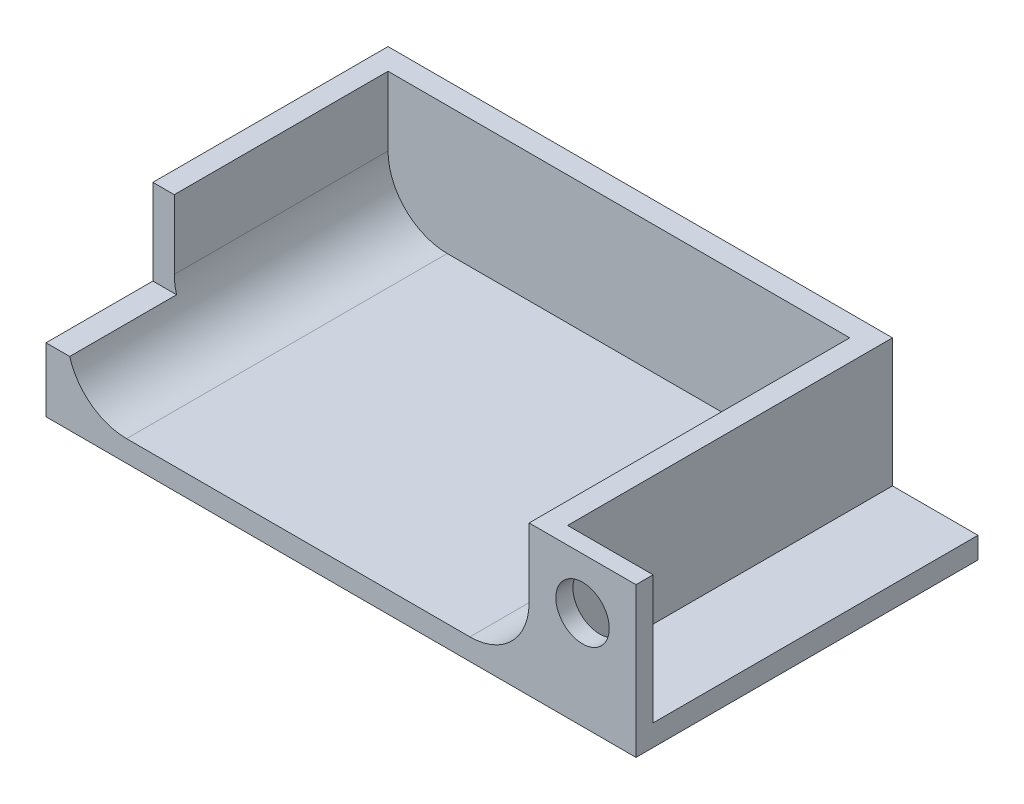
from build123d import *

# Parameters (mm, degrees)
ESQUISSE1_W             = 138
ESQUISSE1_H             = 75
BOSS_EXTRU_1_DEPTH      = 5
ESQUISSE2_W             = 5
ESQUISSE2_H             = 75
ESQUISSE2_W_2           = 25
BOSS_EXTRU_2_DEPTH      = 30
CONG_1_R                = 13.85
ESQUISSE3_W             = 138
ESQUISSE3_H             = 35
BOSS_EXTRU_3_DEPTH      = 5
ESQUISSE4_W             = 25
ESQUISSE4_H             = 20
ENL_V_MAT_EXTRU_1_DEPTH = 6
ESQUISSE5_W             = 20
ESQUISSE5_H             = 76
ENL_V_MAT_EXTRU_2_DEPTH = 30
ESQUISSE6_R             = 6.25
ENL_V_MAT_EXTRU_3_DEPTH = 4


with BuildPart() as part:
    # Esquisse1 → Boss.-Extru.1 (new body)
    with BuildSketch(Plane(origin=(0, 0, 0), x_dir=(1, 0, 0), z_dir=(0, 1, 0))):
        with Locations((69, 37.5)):
            Rectangle(ESQUISSE1_W, ESQUISSE1_H)
    extrude(amount=BOSS_EXTRU_1_DEPTH)

    # Esquisse2 → Boss.-Extru.2 (add)
    with BuildSketch(Plane(origin=(0, 5, 0), x_dir=(1, 0, 0), z_dir=(0, 1, 0))):
        with Locations((2.5, 37.5)):
            Rectangle(ESQUISSE2_W, ESQUISSE2_H)
        with Locations((125.5, 37.5)):
            Rectangle(ESQUISSE2_W_2, ESQUISSE2_H)
    extrude(amount=BOSS_EXTRU_2_DEPTH)

    # Congé1
    cong_1_edges = [part.edges().sort_by_distance(p)[0] for p in [
        (5, 5, -37.5),
        (113, 5, -37.5),
    ]]
    fillet(cong_1_edges, radius=CONG_1_R)

    # Esquisse3 → Boss.-Extru.3 (add)
    with BuildSketch(Plane(origin=(0, 0, -75), x_dir=(-1, 0, 0), z_dir=(0, 0, -1))):
        with Locations((-69, 17.5)):
            Rectangle(ESQUISSE3_W, ESQUISSE3_H)
    extrude(amount=BOSS_EXTRU_3_DEPTH)

    # Esquisse4 → Enlèv. mat.-Extru.1 (cut)
    with BuildSketch(Plane.ZY):
        with Locations((-12.5, 25)):
            Rectangle(ESQUISSE4_W, ESQUISSE4_H)
    extrude(amount=-ENL_V_MAT_EXTRU_1_DEPTH, mode=Mode.SUBTRACT)

    # Esquisse5 → Enlèv. mat.-Extru.2 (cut)
    with BuildSketch(Plane(origin=(0, 35, 0), x_dir=(1, 0, 0), z_dir=(0, 1, 0))):
        with Locations((128, 42)):
            Rectangle(ESQUISSE5_W, ESQUISSE5_H)
    extrude(amount=-ENL_V_MAT_EXTRU_2_DEPTH, mode=Mode.SUBTRACT)

    # Esquisse6 → Enlèv. mat.-Extru.3 (cut)
    with BuildSketch(Plane.XY):
        with Locations((125.5, 23)):
            Circle(ESQUISSE6_R)
    extrude(amount=-ENL_V_MAT_EXTRU_3_DEPTH, mode=Mode.SUBTRACT)


solid = part.part
